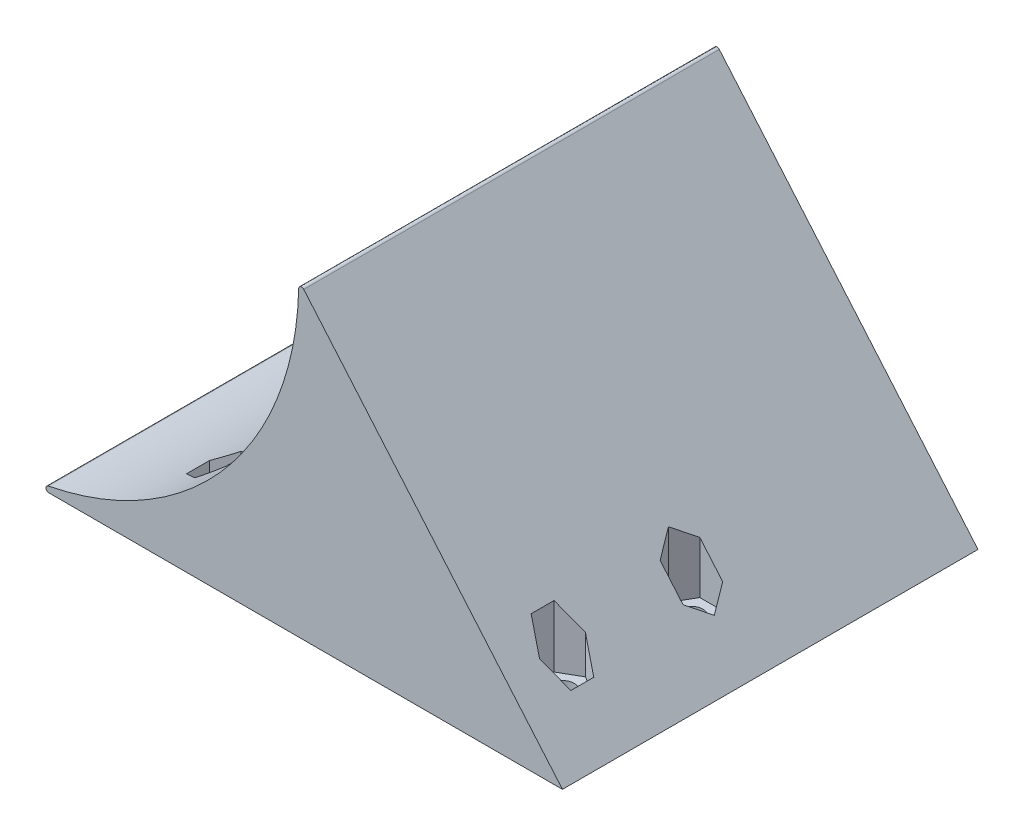
from build123d import *

# Parameters (mm, degrees)
EXTRUDE_1_DEPTH     = 72.5
FILLET_1_R          = 0.5
CUT_EXTRUDE_1_DEPTH = 49
SKETCH_5_R          = 2.05
CUT_EXTRUDE_2_DEPTH = 5
SKETCH_6_R          = 74.194648386
CUT_EXTRUDE_3_DEPTH = 135.804488056


with BuildPart() as part:
    # 草图3 → 凸台-拉伸1 (new, symmetric)
    with BuildSketch(Plane.XY):
        with BuildLine():
            Line((100, -54), (0, -54))
            ThreePointArc((0, -54), (38.183766184, -38.183766184), (54, 0))
            Line((54, 0), (100, -54))
        make_face()
    extrude(amount=EXTRUDE_1_DEPTH, both=True)

    # 圆角1
    fillet_1_edges = [part.edges().sort_by_distance(p)[0] for p in [
        (54, 0, 0),
        (0, -54, 0),
    ]]
    fillet(fillet_1_edges, radius=FILLET_1_R)

    # 草图4 → 切除-拉伸1 (cut)
    with BuildSketch(Plane(origin=(0, 0, 0), x_dir=(1, 0, 0), z_dir=(0, 1, 0))):
        Polygon((93.464101615, -64.5), (93.464101615, -60.5), (90, -58.5), (86.535898385, -60.5), (86.535898385, -64.5), (90, -66.5), align=None)
        Polygon((29.892304845, -58.5), (26.42820323, -60.5), (26.42820323, -64.5), (29.892304845, -66.5), (33.356406461, -64.5), (33.356406461, -60.5), align=None)
        Polygon((33.356406461, 60.5), (29.892304845, 58.5), (26.42820323, 60.5), (26.42820323, 64.5), (29.892304845, 66.5), (33.356406461, 64.5), align=None)
        Polygon((90, 66.5), (93.464101615, 64.5), (93.464101615, 60.5), (90, 58.5), (86.535898385, 60.5), (86.535898385, 64.5), align=None)
        Polygon((92, -36.535898385), (88, -36.535898385), (86, -40), (88, -43.464101615), (92, -43.464101615), (94, -40), align=None)
        Polygon((94, 40), (92, 43.464101615), (88, 43.464101615), (86, 40), (88, 36.535898385), (92, 36.535898385), align=None)
    extrude(amount=-CUT_EXTRUDE_1_DEPTH, mode=Mode.SUBTRACT)

    # 草图5 → 切除-拉伸2 (cut)
    with BuildSketch(Plane(origin=(0, -49, 0), x_dir=(1, 0, 0), z_dir=(0, 1, 0))):
        with Locations(Location((29.892304845, -62.5, 0), (0, 0, 180))):
            Circle(SKETCH_5_R)
        with Locations((29.892304845, 62.5)):
            Circle(SKETCH_5_R)
        with Locations(Location((90, 62.5, 0), (0, 0, 180))):
            Circle(SKETCH_5_R)
        with Locations((90, -62.5)):
            Circle(SKETCH_5_R)
        with Locations(Location((90, 40, 0), (0, 0, 180))):
            Circle(SKETCH_5_R)
        with Locations(Location((90, -40.064560571, 0), (0, 0, 180))):
            Circle(SKETCH_5_R)
    extrude(amount=-CUT_EXTRUDE_2_DEPTH, mode=Mode.SUBTRACT)

    # 草图6 → 切除-拉伸3 (cut, through all)
    with BuildSketch(Plane.XY):
        with Locations((51.898746265, -54)):
            Circle(SKETCH_6_R)
    extrude(amount=-CUT_EXTRUDE_3_DEPTH, mode=Mode.SUBTRACT)


solid = part.part
